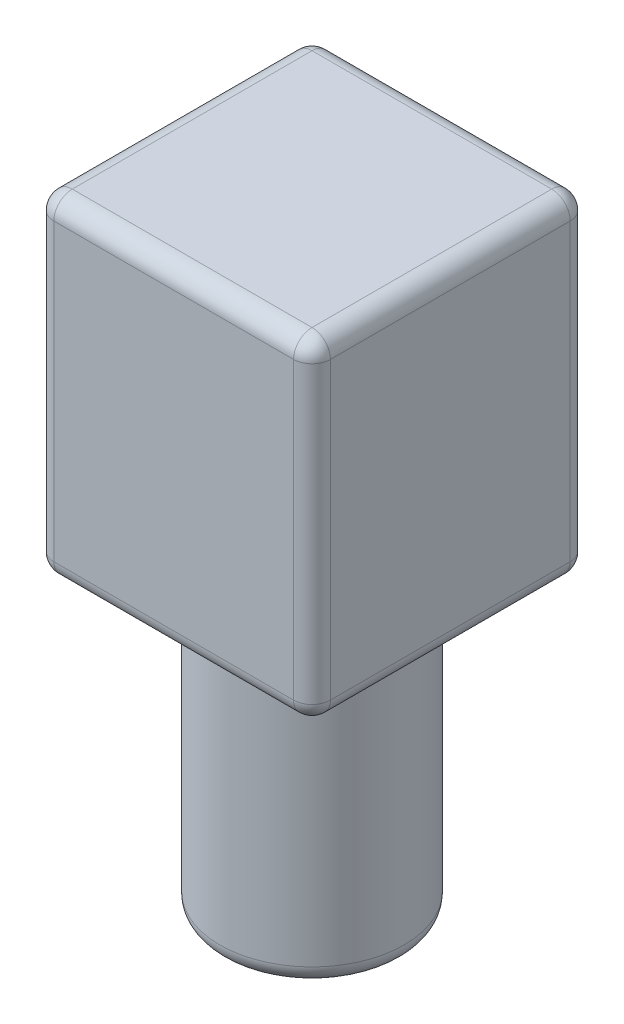
from build123d import *

# Parameters (mm, degrees)
SKETCH1_R           = 10
BOSS_EXTRUDE1_DEPTH = 32
SKETCH2_W           = 30
SKETCH2_H           = 30
BOSS_EXTRUDE2_DEPTH = 36
FILLET1_R           = 2


with BuildPart() as part:
    # Sketch1 → Boss-Extrude1 (new body)
    with BuildSketch(Plane(origin=(0, 0, 0), x_dir=(1, 0, 0), z_dir=(0, 1, 0))):
        with Locations(Location((0, 0, 0), (0, 0, 270))):
            Circle(SKETCH1_R)
    extrude(amount=BOSS_EXTRUDE1_DEPTH)

    # Sketch2 → Boss-Extrude2 (add)
    with BuildSketch(Plane(origin=(0, 32, 0), x_dir=(1, 0, 0), z_dir=(0, 1, 0))):
        Rectangle(SKETCH2_W, SKETCH2_H)
    extrude(amount=BOSS_EXTRUDE2_DEPTH)

    # Fillet1
    fillet1_edges = [part.edges().sort_by_distance(p)[0] for p in [
        (0, 0, -10),
        (-15, 68, 0),
        (-15, 50, -15),
        (0, 32, 15),
        (-15, 50, 15),
        (15, 32, 0),
        (15, 50, 15),
        (0, 68, -15),
        (15, 50, -15),
        (0, 68, 15),
        (15, 68, 0),
        (-15, 32, 0),
        (0, 32, -15),
    ]]
    fillet(fillet1_edges, radius=FILLET1_R)


solid = part.part
